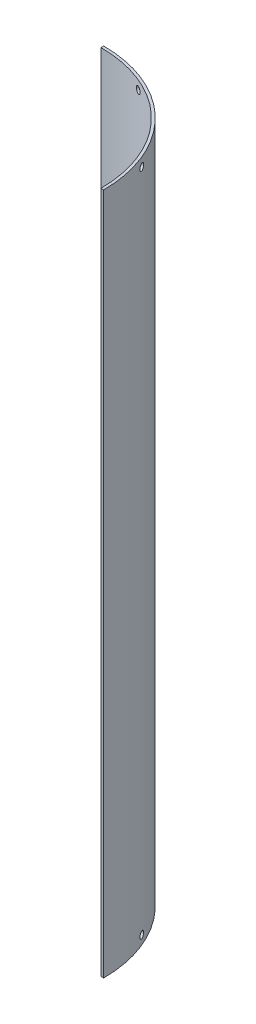
from build123d import *

# Parameters (mm, degrees)
BOSS_EXTRUDE1_DEPTH     = 504
CUT_EXTRUDE2_REACH      = 516.263
CUT_EXTRUDE2_END_RADIUS = 90
SKETCH3_R               = 2.5
CUT_EXTRUDE3_REACH      = 516.263
CUT_EXTRUDE3_END_RADIUS = 90
SKETCH5_R               = 2.5
LPATTERN2_COUNT         = 2
LPATTERN2_PITCH         = 491


with BuildPart() as part:
    # Sketch1 → Boss-Extrude1 (new body)
    with BuildSketch(Plane(origin=(0, 0, 0), x_dir=(1, 0, 0), z_dir=(0, 1, 0))):
        with BuildLine():
            Line((0, 92), (0, 90))
            ThreePointArc((0, 90), (63.639610307, 63.639610307), (90, 0))
            Line((90, 0), (92, 0))
            ThreePointArc((92, 0), (65.053823869, 65.053823869), (0, 92))
        make_face()
    extrude(amount=BOSS_EXTRUDE1_DEPTH)

    # Cut-Extrude2: up to this cylinder (the profile starts outside it)
    cut_extrude2_end = Plane(origin=(0, 6.5, 0), z_dir=(0, -1, 0)) * Cylinder(CUT_EXTRUDE2_END_RADIUS, 1213.526, mode=Mode.PRIVATE)
    # Sketch3 → Cut-Extrude2 (cut, up to the surface)
    with BuildSketch(Plane(origin=(84.996916991, 0, -35.206875778), x_dir=(-0.38268343236509045, 0, -0.9238795325112865), z_dir=(0.9238795325112865, 0, -0.38268343236509045)), mode=Mode.PRIVATE) as cut_extrude2_sk1:
        with Locations((0, 6.5)):
            Circle(SKETCH3_R)
    cut_extrude2_tool1 = extrude(cut_extrude2_sk1.sketch, amount=-CUT_EXTRUDE2_REACH, mode=Mode.PRIVATE) - cut_extrude2_end
    cut_extrude2 = cut_extrude2_tool1.solids().sort_by_distance((84.996917, 6.5, -35.206876))[0]
    add(cut_extrude2, mode=Mode.SUBTRACT)

    # Cut-Extrude3: up to this cylinder (the profile starts outside it)
    cut_extrude3_end = Plane(origin=(0, 6.5, 0), z_dir=(0, -1, 0)) * Cylinder(CUT_EXTRUDE3_END_RADIUS, 1213.526, mode=Mode.PRIVATE)
    # Sketch5 → Cut-Extrude3 (cut, up to the surface)
    with BuildSketch(Plane(origin=(35.206875778, 0, -84.996916991), x_dir=(-0.9238795325112878, 0, -0.3826834323650876), z_dir=(0.3826834323650876, 0, -0.9238795325112878)), mode=Mode.PRIVATE) as cut_extrude3_sk1:
        with Locations((0, 6.5)):
            Circle(SKETCH5_R)
    cut_extrude3_tool1 = extrude(cut_extrude3_sk1.sketch, amount=-CUT_EXTRUDE3_REACH, mode=Mode.PRIVATE) - cut_extrude3_end
    cut_extrude3 = cut_extrude3_tool1.solids().sort_by_distance((35.206876, 6.5, -84.996917))[0]
    add(cut_extrude3, mode=Mode.SUBTRACT)

    # LPattern2: Cut-Extrude2, Cut-Extrude3 ×2
    with Locations(*[(0, i * LPATTERN2_PITCH, 0) for i in range(1, LPATTERN2_COUNT)]):
        add(cut_extrude2, mode=Mode.SUBTRACT)
        add(cut_extrude3, mode=Mode.SUBTRACT)


solid = part.part
